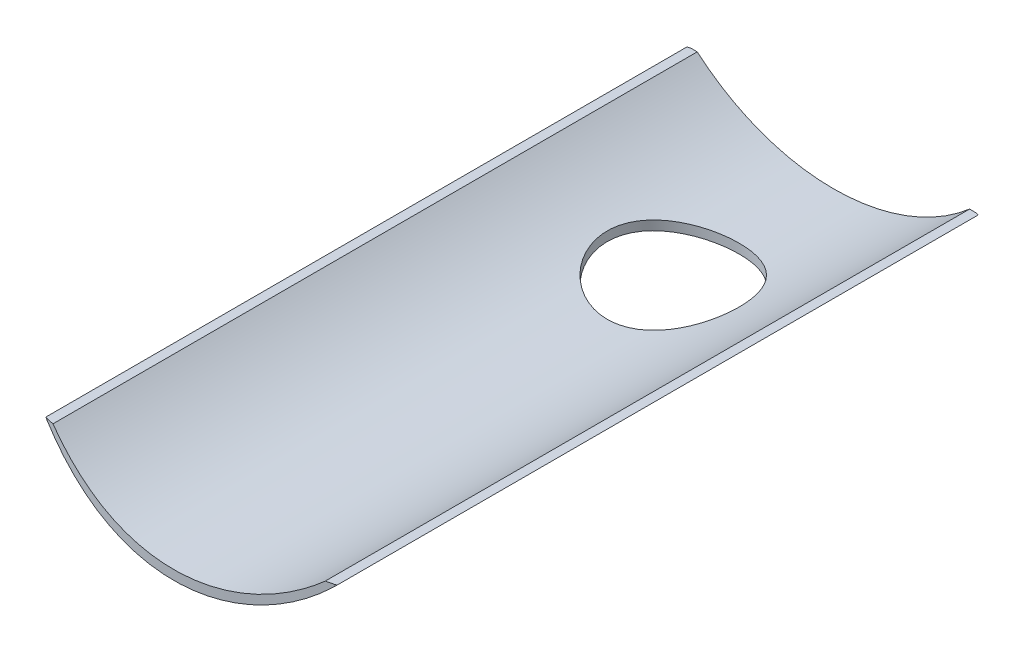
from build123d import *

# Parameters (mm, degrees)
BOSS_EXTRUDE1_DEPTH = 8
FILLET1_R           = 0.5
SKETCH2_R           = 3.5
CUT_EXTRUDE1_DEPTH  = 22.5
SKETCH5_OUTSIDE_W   = 25.862
SKETCH5_OUTSIDE_H   = 17.862
CUT_EXTRUDE2_DEPTH  = 39.5
SKETCH6_OUTSIDE_W   = 25.128
SKETCH6_OUTSIDE_H   = 12.878
CUT_EXTRUDE3_DEPTH  = 39.5


with BuildPart() as part:
    # Sketch1 → Boss-Extrude1 (new body)
    with BuildSketch(Plane(origin=(0, 0, 0), x_dir=(1, 0, 0), z_dir=(0, 1, 0))):
        with BuildLine():
            Line((8, -16.5), (8, 17.5))
            Line((8, 17.5), (-8, 17.5))
            Line((-8, 17.5), (-8, -16.5))
            ThreePointArc((-8, -16.5), (0, -17.5), (8, -16.5))
        make_face()
    extrude(amount=BOSS_EXTRUDE1_DEPTH)

    # Fillet1
    fillet1_edges = [part.edges().sort_by_distance(p)[0] for p in [
        (-8, 4, -17.5),
        (8, 4, -17.5),
        (8, 4, 16.5),
        (-8, 4, 16.5),
    ]]
    fillet(fillet1_edges, radius=FILLET1_R)

    # Sketch2 → Cut-Extrude1 (cut)
    with BuildSketch(Plane(origin=(0, 8, 0), x_dir=(1, 0, 0), z_dir=(0, 1, 0))):
        with Locations(Location((0, 9, 0), (0, 0, 270))):
            Circle(SKETCH2_R)
    extrude(amount=-CUT_EXTRUDE1_DEPTH, mode=Mode.SUBTRACT)

    # Sketch5 outside → Cut-Extrude2 (cut, symmetric)
    with BuildSketch(Plane(origin=(0, 0, -17.5), x_dir=(-1, 0, 0), z_dir=(0, 0, -1))):
        with Locations((0, 4)):
            Rectangle(SKETCH5_OUTSIDE_W, SKETCH5_OUTSIDE_H)
        with BuildLine():
            Line((0, 8), (-7.725, 8))
            ThreePointArc((-7.725, 8), (0, 4.8), (7.725, 8))
            Line((7.725, 8), (0, 8))
        make_face(mode=Mode.SUBTRACT)
    extrude(amount=CUT_EXTRUDE2_DEPTH, both=True, mode=Mode.SUBTRACT)

    # Sketch6 outside → Cut-Extrude3 (cut, symmetric)
    with BuildSketch(Plane(origin=(0, 0, -17.5), x_dir=(-1, 0, 0), z_dir=(0, 0, -1))):
        with Locations((0, 6.4)):
            Rectangle(SKETCH6_OUTSIDE_W, SKETCH6_OUTSIDE_H)
        with BuildLine():
            Line((-7.725, 8), (-7.225, 8))
            ThreePointArc((-7.225, 8), (0, 5.320884761), (7.225, 8))
            Line((7.225, 8), (7.725, 8))
            ThreePointArc((7.725, 8), (0, 4.820884761), (-7.725, 8))
        make_face(mode=Mode.SUBTRACT)
    extrude(amount=CUT_EXTRUDE3_DEPTH, both=True, mode=Mode.SUBTRACT)


solid = part.part
